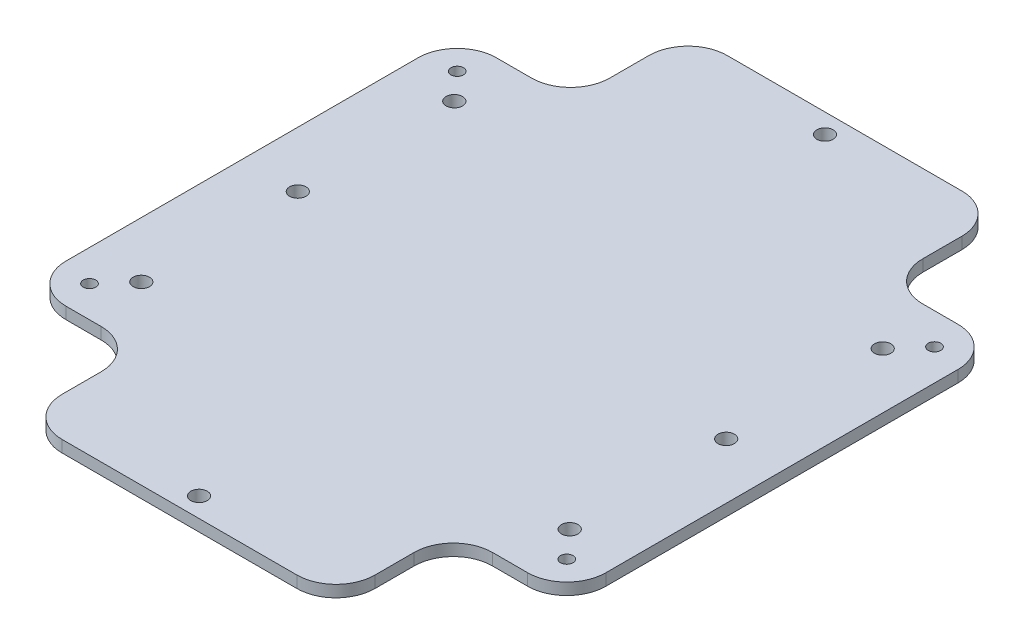
from build123d import *

# Parameters (mm, degrees)
SKETCH1_W           = 138
SKETCH1_H           = 170
BOSS_EXTRUDE1_DEPTH = 3
SKETCH2_R           = 2.1
SKETCH2_W           = 29
SKETCH2_H           = 30
CUT_EXTRUDE1_DEPTH  = 3
SKETCH3_R           = 2.1
SKETCH3_R_2         = 1.6
CUT_EXTRUDE2_DEPTH  = 219.981734398
FILLET1_R           = 10


with BuildPart() as part:
    # Sketch1 → Boss-Extrude1 (new body)
    with BuildSketch(Plane(origin=(0, 0, 0), x_dir=(1, 0, 0), z_dir=(0, 1, 0))):
        with Locations((69, 85)):
            Rectangle(SKETCH1_W, SKETCH1_H)
    extrude(amount=BOSS_EXTRUDE1_DEPTH)

    # Sketch2 → Cut-Extrude1 (cut)
    with BuildSketch(Plane(origin=(0, 3, 0), x_dir=(1, 0, 0), z_dir=(0, 1, 0))):
        with Locations(Location((69, 165, 0), (0, 0, 270))):
            Circle(SKETCH2_R)
        with Locations(Location((69, 5, 0), (0, 0, 270))):
            Circle(SKETCH2_R)
        with Locations((14.5, 155)):
            Rectangle(SKETCH2_W, SKETCH2_H)
        with Locations((123.5, 155)):
            Rectangle(SKETCH2_W, SKETCH2_H)
        with Locations((123.5, 15)):
            Rectangle(SKETCH2_W, SKETCH2_H)
        with Locations((14.5, 15)):
            Rectangle(SKETCH2_W, SKETCH2_H)
    extrude(amount=-CUT_EXTRUDE1_DEPTH, mode=Mode.SUBTRACT)

    # Sketch3 → Cut-Extrude2 (cut, through all)
    with BuildSketch(Plane(origin=(0, 3, 0), x_dir=(1, 0, 0), z_dir=(0, 1, 0))):
        with Locations(Location((14.25, 125, 0), (0, 0, 270))):
            Circle(SKETCH3_R)
        with Locations(Location((14.25, 45, 0), (0, 0, 270))):
            Circle(SKETCH3_R)
        with Locations(Location((14.25, 85, 0), (0, 0, 270))):
            Circle(SKETCH3_R)
        with Locations(Location((123.75, 45, 0), (0, 0, 90))):
            Circle(SKETCH3_R)
        with Locations(Location((123.75, 85, 0), (0, 0, 90))):
            Circle(SKETCH3_R)
        with Locations(Location((123.75, 125, 0), (0, 0, 90))):
            Circle(SKETCH3_R)
        with Locations(Location((8, 132, 0), (0, 0, 270))):
            Circle(SKETCH3_R_2)
        with Locations(Location((8, 38, 0), (0, 0, 270))):
            Circle(SKETCH3_R_2)
        with Locations(Location((130, 38, 0), (0, 0, 90))):
            Circle(SKETCH3_R_2)
        with Locations(Location((130, 132, 0), (0, 0, 90))):
            Circle(SKETCH3_R_2)
    extrude(amount=-CUT_EXTRUDE2_DEPTH, mode=Mode.SUBTRACT)

    # Fillet1
    fillet1_edges = [part.edges().sort_by_distance(p)[0] for p in [
        (138, 1.5, -140),
        (109, 1.5, -140),
        (109, 1.5, -170),
        (138, 1.5, -30),
        (109, 1.5, 0),
        (109, 1.5, -30),
        (0, 1.5, -30),
        (29, 1.5, -30),
        (29, 1.5, 0),
        (0, 1.5, -140),
        (29, 1.5, -170),
        (29, 1.5, -140),
    ]]
    fillet(fillet1_edges, radius=FILLET1_R)


solid = part.part
